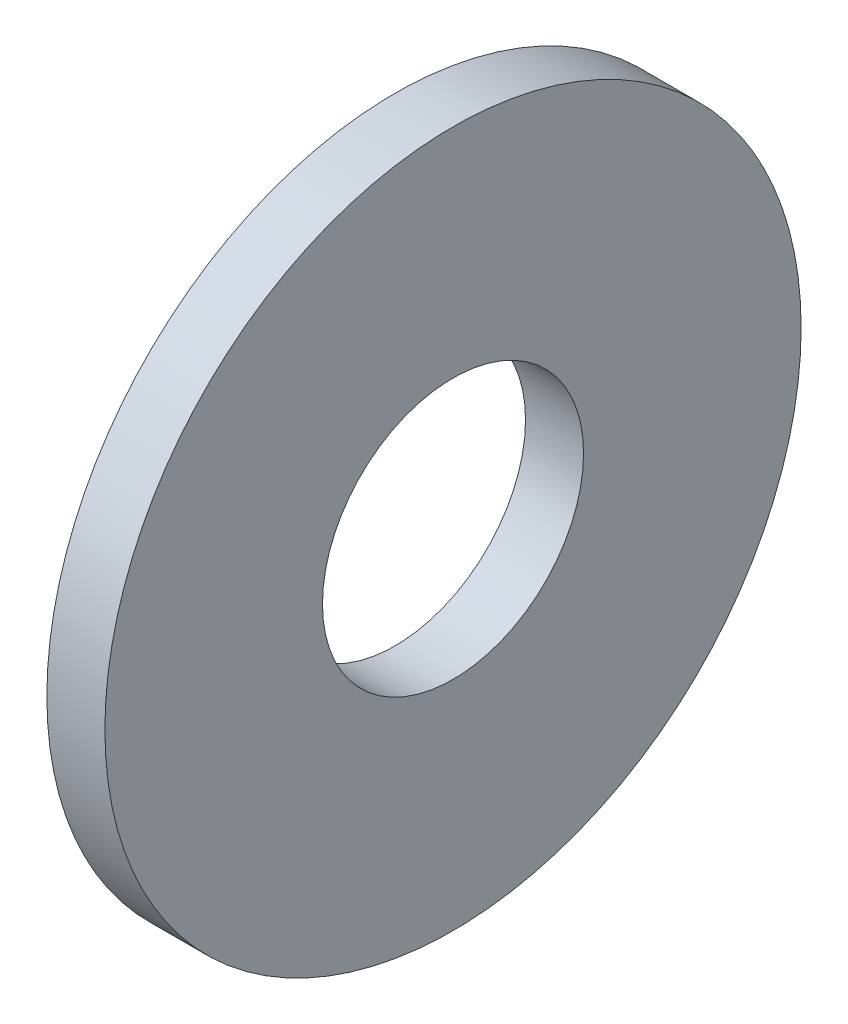
from build123d import *

# Parameters (mm, degrees)
SKETCH1_R           = 38.1
SKETCH1_R_2         = 14.2875
BOSS_EXTRUDE1_DEPTH = 3.175


with BuildPart() as part:
    # Sketch1 → Boss-Extrude1 (new, symmetric)
    with BuildSketch(Plane(origin=(0, 0, 0), x_dir=(0, 0, -1), z_dir=(1, 0, 0))):
        Circle(SKETCH1_R)
        Circle(SKETCH1_R_2, mode=Mode.SUBTRACT)
    extrude(amount=BOSS_EXTRUDE1_DEPTH, both=True)


solid = part.part
